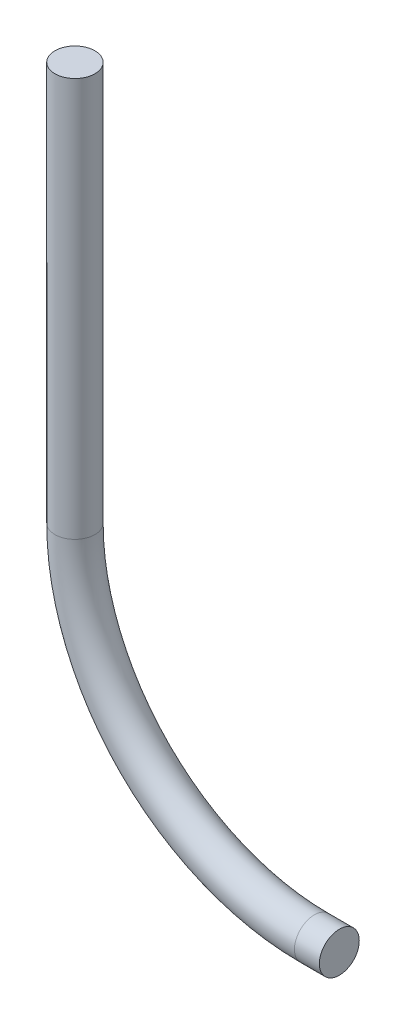
from build123d import *

# Parameters (mm, degrees)
SKETCH2_R = 4


with BuildPart() as part:
    # Sweep1: sweep along a path in Sketch1
    with BuildLine(Plane.XY) as sweep1_path:
        Line((0, 0), (-5, 0))
        ThreePointArc((-5, 0), (-38.941125497, 14.058874503), (-53, 48))
        Line((-53, 48), (-53, 128))
    # Sketch2 → Sweep1 (sweep)
    with BuildSketch(Plane(origin=(0, 0, 0), x_dir=(0, 0, -1), z_dir=(1, 0, 0))):
        Circle(SKETCH2_R)
    sweep(path=sweep1_path.line)


solid = part.part
